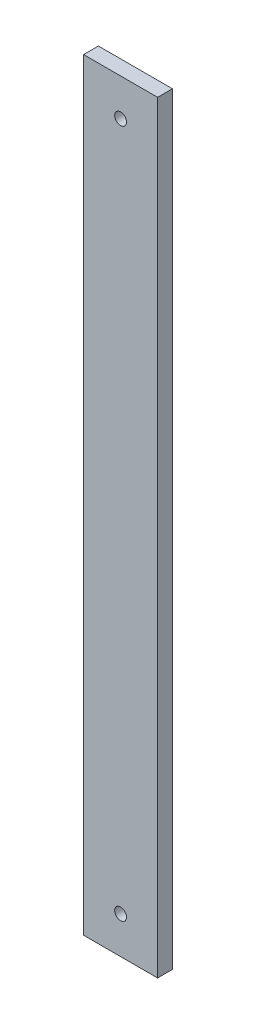
from build123d import *

# Parameters (mm, degrees)
SKETCH_1_W      = 20
SKETCH_1_H      = 206
SKETCH_1_R      = 1.6
EXTRUDE_1_DEPTH = 4


with BuildPart() as part:
    # 草图1 → 凸台-拉伸1 (new body)
    with BuildSketch(Plane.XY):
        Rectangle(SKETCH_1_W, SKETCH_1_H)
        with Locations((0, 93)):
            Circle(SKETCH_1_R, mode=Mode.SUBTRACT)
        with Locations(Location((0, -93, 0), (0, 0, 180))):
            Circle(SKETCH_1_R, mode=Mode.SUBTRACT)
    extrude(amount=EXTRUDE_1_DEPTH)


solid = part.part
